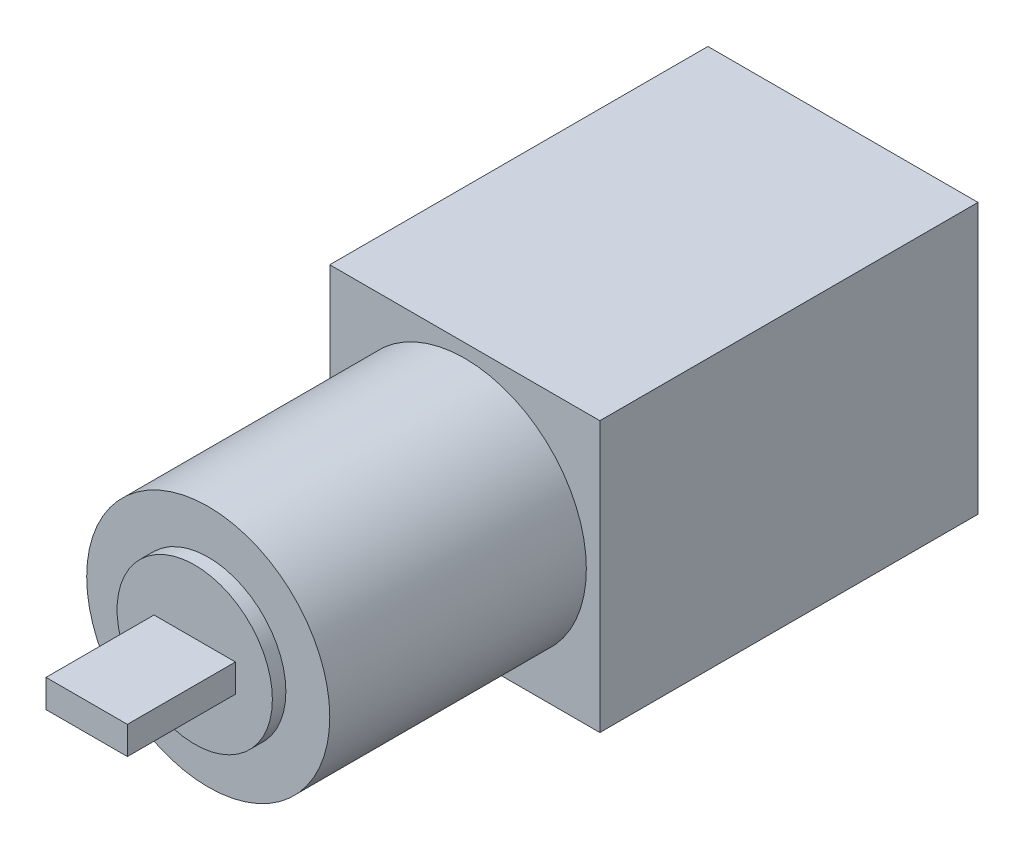
from build123d import *

# Parameters (mm, degrees)
ESQUISSE1_W        = 40
ESQUISSE1_H        = 40
BOSS_EXTRU_1_DEPTH = 56
ESQUISSE2_R        = 18
BOSS_EXTRU_2_DEPTH = 38
ESQUISSE3_R        = 11.5
BOSS_EXTRU_3_DEPTH = 2
ESQUISSE4_W        = 12.050195296
ESQUISSE4_H        = 4.136634206
BOSS_EXTRU_4_DEPTH = 16


with BuildPart() as part:
    # Esquisse1 → Boss.-Extru.1 (new body)
    with BuildSketch(Plane.XY):
        with Locations((20, 20)):
            Rectangle(ESQUISSE1_W, ESQUISSE1_H)
    extrude(amount=BOSS_EXTRU_1_DEPTH)

    # Esquisse2 → Boss.-Extru.2 (add)
    with BuildSketch(Plane.XY.offset(56)):
        with Locations((20, 20)):
            Circle(ESQUISSE2_R)
    extrude(amount=BOSS_EXTRU_2_DEPTH)

    # Esquisse3 → Boss.-Extru.3 (add)
    with BuildSketch(Plane.XY.offset(94)):
        with Locations((20, 20)):
            Circle(ESQUISSE3_R)
    extrude(amount=BOSS_EXTRU_3_DEPTH)

    # Esquisse4 → Boss.-Extru.4 (add)
    with BuildSketch(Plane.XY.offset(96)):
        with Locations((20, 20)):
            Rectangle(ESQUISSE4_W, ESQUISSE4_H)
    extrude(amount=BOSS_EXTRU_4_DEPTH)


solid = part.part
